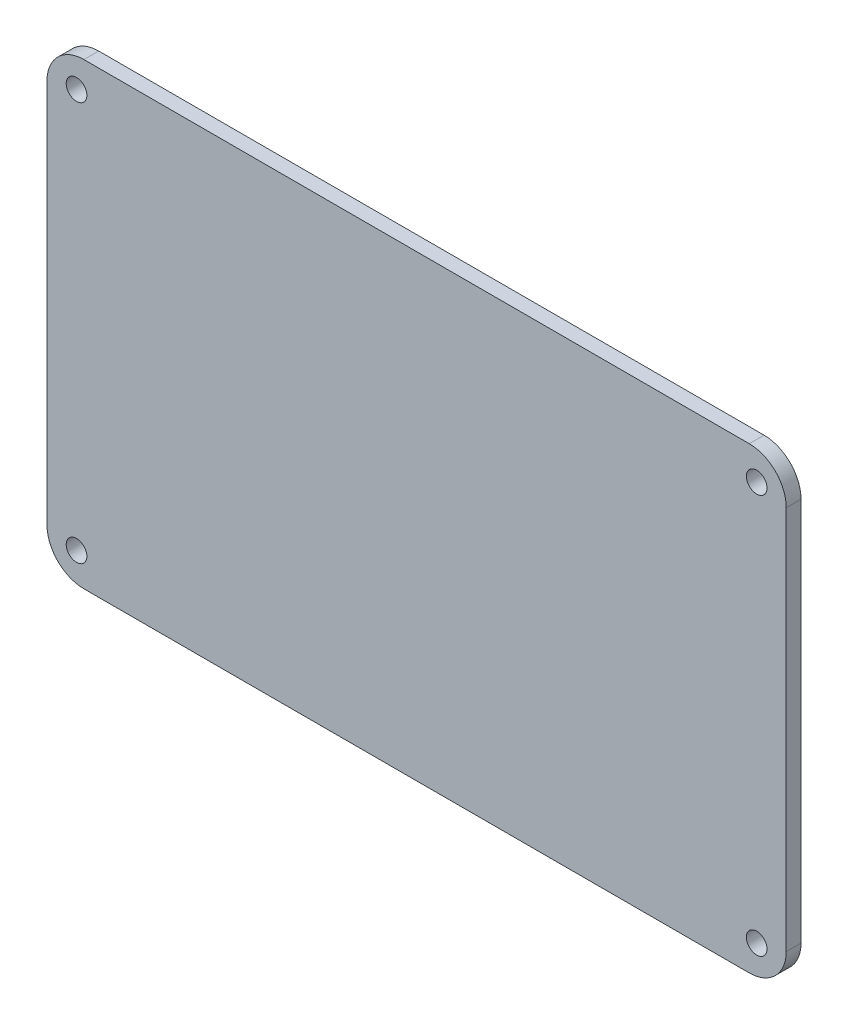
from build123d import *

# Parameters (mm, degrees)
SKETCH_1_W      = 100
SKETCH_1_H      = 62
SKETCH_1_R      = 1.4
EXTRUDE_1_DEPTH = 2
FILLET_1_R      = 5


with BuildPart() as part:
    # 草图1 → 凸台-拉伸1 (new body)
    with BuildSketch(Plane.XY):
        with Locations((50, 31)):
            Rectangle(SKETCH_1_W, SKETCH_1_H)
        with Locations((4, 58)):
            Circle(SKETCH_1_R, mode=Mode.SUBTRACT)
        with Locations(Location((4, 4, 0), (0, 0, 180))):
            Circle(SKETCH_1_R, mode=Mode.SUBTRACT)
        with Locations((96, 4)):
            Circle(SKETCH_1_R, mode=Mode.SUBTRACT)
        with Locations(Location((96, 58, 0), (0, 0, 180))):
            Circle(SKETCH_1_R, mode=Mode.SUBTRACT)
    extrude(amount=EXTRUDE_1_DEPTH)

    # 圆角1
    fillet_1_edges = [part.edges().sort_by_distance(p)[0] for p in [
        (0, 62, 1),
        (100, 62, 1),
        (100, 0, 1),
        (0, 0, 1),
    ]]
    fillet(fillet_1_edges, radius=FILLET_1_R)


solid = part.part
